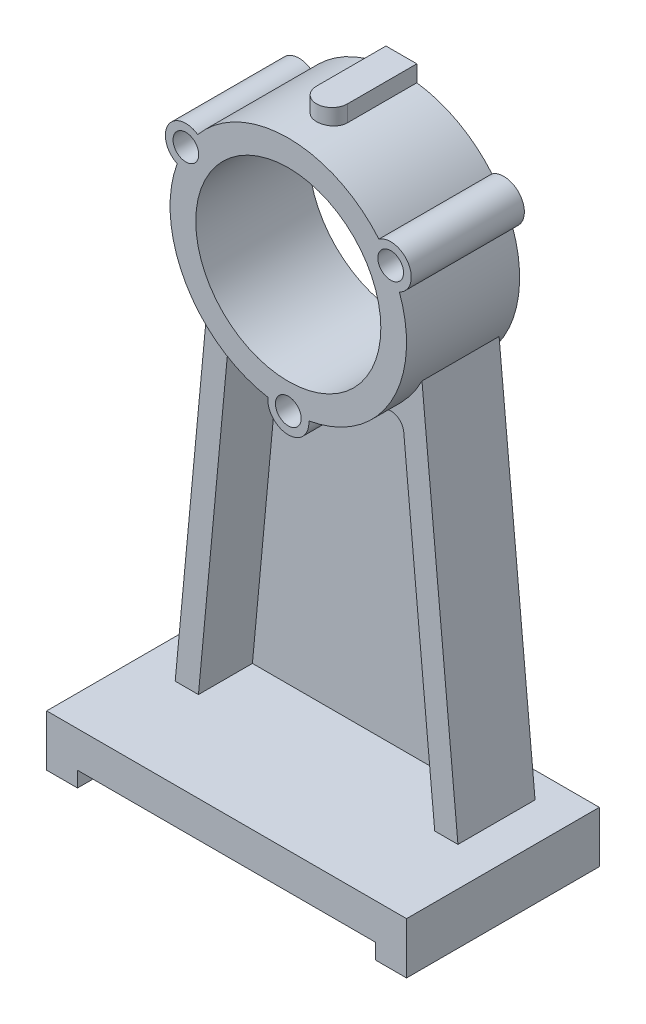
from build123d import *

# Parameters (mm, degrees)
EXTRUDE_1_DEPTH             = 44
SKETCH_2_W                  = 75
SKETCH_2_H                  = 20
EXTRUDE_2_DEPTH             = 70
EXTRUDE_3_DEPTH             = 30
EXTRUDE_4_REACH             = 215.598
SKETCH_4_W                  = 9
SKETCH_4_H                  = 170
EXTRUDE_4_DIRECTION_2_REACH = 215.598
EXTRUDE_5_DEPTH             = 52
CUT_EXTRUDE_1_DEPTH         = 214.597752797
CUT_EXTRUDE_1_DEPTH_BACK    = 214.597752797
SKETCH_6_R                  = 36
SKETCH_6_R_2                = 5
SKETCH_6_W                  = 116
SKETCH_6_H                  = 6


with BuildPart() as part:
    # 草图1 → 凸台-拉伸1 (new body)
    with BuildSketch(Plane.XY):
        with BuildLine():
            ThreePointArc((7.969696861, -45.304347826), (39.837168574, -23), (43.21956455, 15.750213971))
            ThreePointArc((43.21956455, 15.750213971), (46.765371804, 27), (35.249867689, 29.554133855))
            ThreePointArc((35.249867689, 29.554133855), (0, 46), (-35.249867689, 29.554133855))
            ThreePointArc((-35.249867689, 29.554133855), (-46.765371804, 27), (-43.21956455, 15.750213971))
            ThreePointArc((-43.21956455, 15.750213971), (-39.837168574, -23), (-7.969696861, -45.304347826))
            ThreePointArc((-7.969696861, -45.304347826), (0, -54), (7.969696861, -45.304347826))
        make_face()
    extrude(amount=EXTRUDE_1_DEPTH)



with BuildPart() as body_2:
    # 草图2 → 凸台-拉伸2 (new, symmetric)
    with BuildSketch(Plane(origin=(0, 0, 0), x_dir=(0, 0, -1), z_dir=(1, 0, 0))):
        with Locations((-30.5, -180)):
            Rectangle(SKETCH_2_W, SKETCH_2_H)
    extrude(amount=EXTRUDE_2_DEPTH, both=True)


with BuildPart() as part_1:
    add(part.part)

    add(body_2.part)  # 凸台-拉伸3 merges body 2
    # 草图3 → 凸台-拉伸3 (add)
    with BuildSketch(Plane.XY.offset(3)):
        with BuildLine():
            Line((55, -170), (45.960435355, -170))
            Line((45.960435355, -170), (33.901757224, -41.537742182))
            ThreePointArc((33.901757224, -41.537742182), (31.040174213, -37.475102515), (26.087990263, -37.886894358))
            ThreePointArc((26.087990263, -37.886894358), (34.60790205, -30.303351559), (41, -20.856653615))
            Line((41, -20.856653615), (55, -170))
        make_face()
        with BuildLine():
            Line((-33.901757224, -41.537742182), (-45.960435355, -170))
            Line((-45.960435355, -170), (-55, -170))
            Line((-55, -170), (-41, -20.856653615))
            ThreePointArc((-41, -20.856653615), (-34.60790205, -30.303351559), (-26.087990263, -37.886894358))
            ThreePointArc((-26.087990263, -37.886894358), (-31.040174213, -37.475102515), (-33.901757224, -41.537742182))
        make_face()
    extrude(amount=EXTRUDE_3_DEPTH)

    # 草图4 → 凸台-拉伸4 (add, up to next)
    with BuildSketch(Plane(origin=(0, 0, 0), x_dir=(0, 0, -1), z_dir=(1, 0, 0)), mode=Mode.PRIVATE) as extrude_4_sk1:
        with Locations((-7.5, -85)):
            Rectangle(SKETCH_4_W, SKETCH_4_H)
    extrude_4_tool1 = extrude(extrude_4_sk1.sketch, amount=EXTRUDE_4_REACH, mode=Mode.PRIVATE) - part_1.part
    add(extrude_4_tool1.solids().sort_by_distance((0, -85, 7.5))[0])

    # 草图4 → 凸台-拉伸4 direction 2 (add, up to next)
    with BuildSketch(Plane(origin=(0, 0, 0), x_dir=(0, 0, -1), z_dir=(1, 0, 0)), mode=Mode.PRIVATE) as extrude_4_direction_2_sk1:
        with Locations((-7.5, -85)):
            Rectangle(SKETCH_4_W, SKETCH_4_H)
    extrude_4_direction_2_tool1 = extrude(extrude_4_direction_2_sk1.sketch, amount=-EXTRUDE_4_DIRECTION_2_REACH, mode=Mode.PRIVATE) - part_1.part
    add(extrude_4_direction_2_tool1.solids().sort_by_distance((0, -85, 7.5))[0])

    # 草图5 → 凸台-拉伸5 (add)
    with BuildSketch(Plane(origin=(0, 0, 0), x_dir=(1, 0, 0), z_dir=(0, 1, 0))):
        with BuildLine():
            Line((-6, -27), (-6, 0))
            Line((-6, 0), (6, 0))
            Line((6, 0), (6, -27))
            ThreePointArc((6, -27), (0, -33), (-6, -27))
        make_face()
    extrude(amount=EXTRUDE_5_DEPTH)

    # 草图6 → 切除-拉伸1 (cut, two sides: drawn at the far end of the back side and taken through both)
    with BuildSketch(Plane.XY.offset(-CUT_EXTRUDE_1_DEPTH_BACK)):
        Circle(SKETCH_6_R)
        with Locations((0, -46)):
            Circle(SKETCH_6_R_2)
        with Locations((-39.837168574, 23)):
            Circle(SKETCH_6_R_2)
        with Locations((39.837168574, 23)):
            Circle(SKETCH_6_R_2)
        with Locations((0, -187)):
            Rectangle(SKETCH_6_W, SKETCH_6_H)
    extrude(amount=CUT_EXTRUDE_1_DEPTH + CUT_EXTRUDE_1_DEPTH_BACK, mode=Mode.SUBTRACT)


solid = part_1.part
